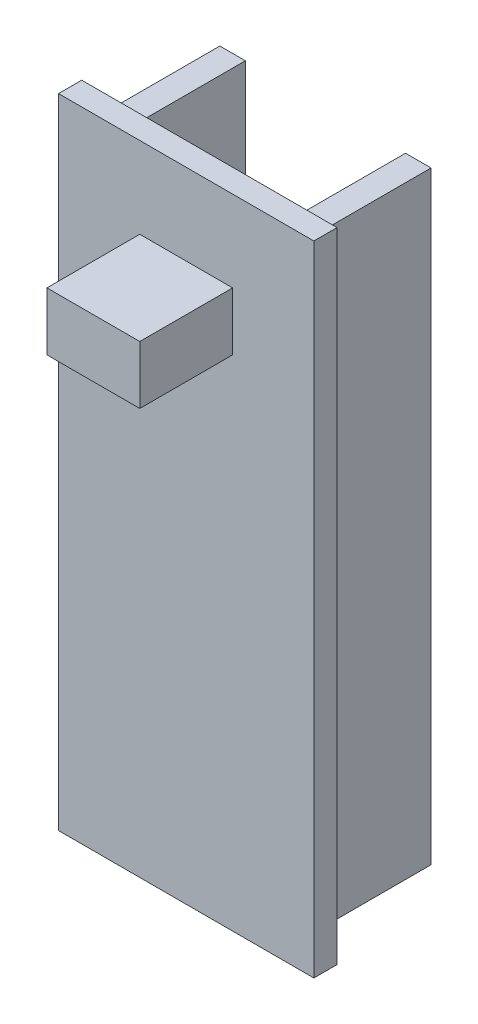
from build123d import *

# Parameters (mm, degrees)
SKETCH_1_W      = 22
SKETCH_1_H      = 55
EXTRUDE_1_DEPTH = 2
SKETCH_2_W      = 2.2
SKETCH_2_H      = 52
EXTRUDE_2_DEPTH = 10
SKETCH_4_W      = 8
SKETCH_4_H      = 5
EXTRUDE_3_DEPTH = 8


with BuildPart() as part:
    # 草图1 → 凸台-拉伸1 (new body)
    with BuildSketch(Plane.XY):
        Rectangle(SKETCH_1_W, SKETCH_1_H)
    extrude(amount=EXTRUDE_1_DEPTH)

    # 草图2 → 凸台-拉伸2 (add)
    with BuildSketch(Plane.XY):
        with Locations((8, 0)):
            Rectangle(SKETCH_2_W, SKETCH_2_H)
        with Locations((-8, 0)):
            Rectangle(SKETCH_2_W, SKETCH_2_H)
    extrude(amount=-EXTRUDE_2_DEPTH)

    # 草图4 → 凸台-拉伸3 (add)
    with BuildSketch(Plane.XY.offset(2)):
        with Locations((0, 18)):
            Rectangle(SKETCH_4_W, SKETCH_4_H)
    extrude(amount=EXTRUDE_3_DEPTH)


solid = part.part
